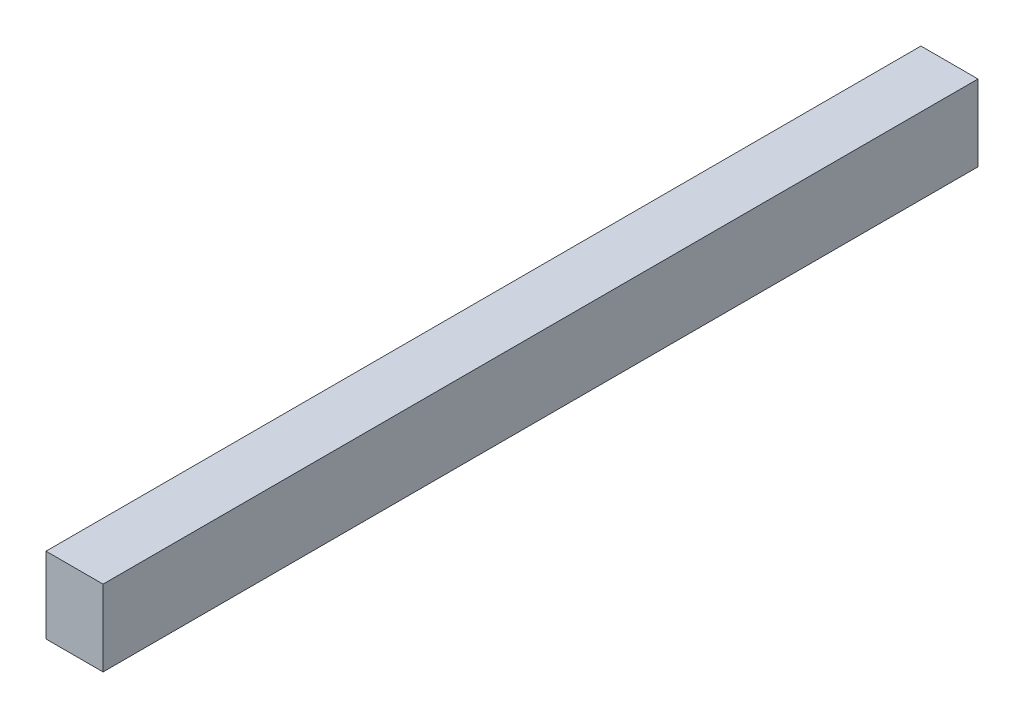
from build123d import *

# Parameters (mm, degrees)
SKETCH1_W           = 150
SKETCH1_H           = 200
BOSS_EXTRUDE1_DEPTH = 2300


with BuildPart() as part:
    # Sketch1 → Boss-Extrude1 (new body)
    with BuildSketch(Plane.XY):
        with Locations((47.39455119, -66.55015437)):
            Rectangle(SKETCH1_W, SKETCH1_H)
    extrude(amount=BOSS_EXTRUDE1_DEPTH)


solid = part.part
